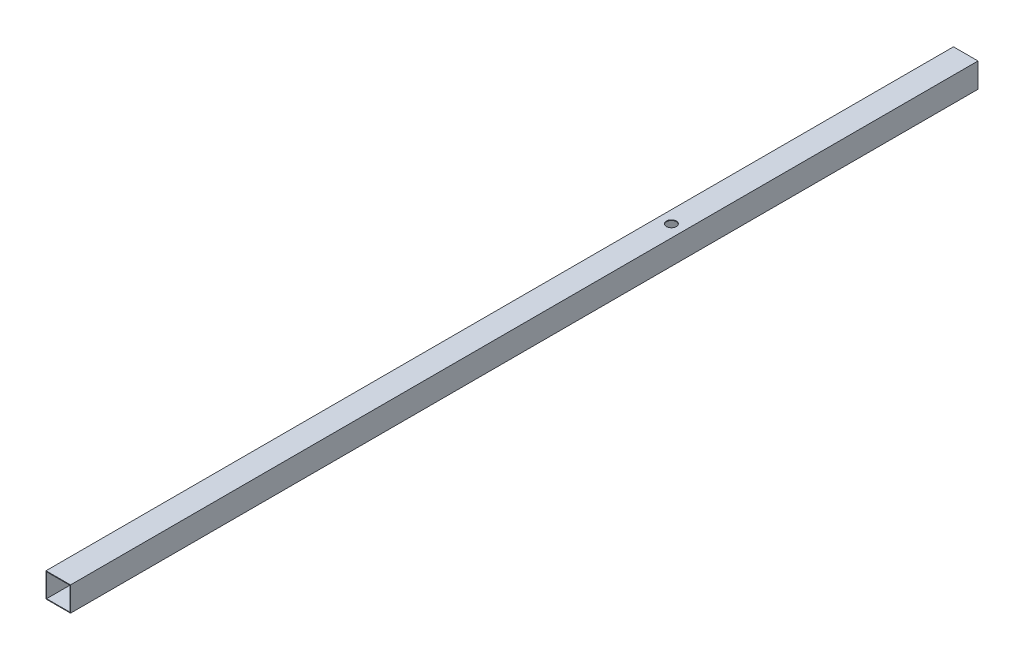
from build123d import *

# Parameters (mm, degrees)
SKETCH2_W           = 20
SKETCH2_H           = 20
BOSS_EXTRUDE1_DEPTH = 740
SKETCH3_W           = 19
SKETCH3_H           = 19
CUT_EXTRUDE1_DEPTH  = 740
SKETCH5_R           = 4
CUT_EXTRUDE2_DEPTH  = 20


with BuildPart() as part:
    # Sketch2 → Boss-Extrude1 (new body)
    with BuildSketch(Plane.XY):
        Rectangle(SKETCH2_W, SKETCH2_H)
    extrude(amount=BOSS_EXTRUDE1_DEPTH)

    # Sketch3 → Cut-Extrude1 (cut)
    with BuildSketch(Plane(origin=(0, 0, 0), x_dir=(-1, 0, 0), z_dir=(0, 0, -1))):
        Rectangle(SKETCH3_W, SKETCH3_H)
    extrude(amount=-CUT_EXTRUDE1_DEPTH, mode=Mode.SUBTRACT)

    # Sketch5 → Cut-Extrude2 (cut)
    with BuildSketch(Plane.XZ.offset(10)):
        with Locations(Location((0, 240, 0), (0, 0, 270))):
            Circle(SKETCH5_R)
    extrude(amount=-CUT_EXTRUDE2_DEPTH, mode=Mode.SUBTRACT)


solid = part.part
